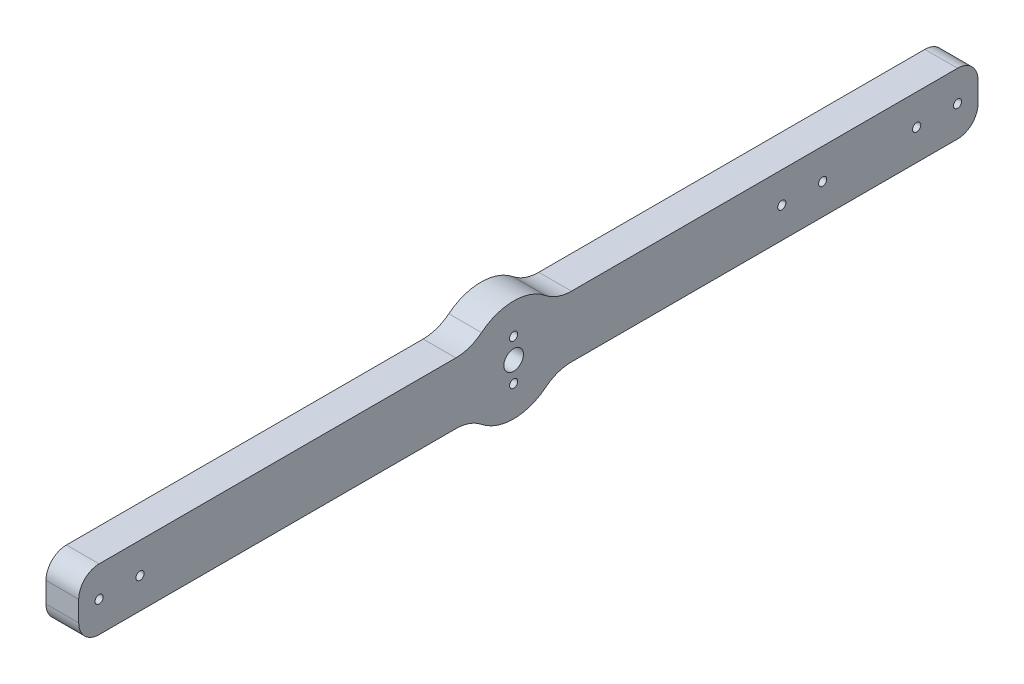
from build123d import *

# Parameters (mm, degrees)
SKETCH_1_W               = 120
SKETCH_1_H               = 15
EXTRUDE_1_DEPTH          = 8
FILLET_1_R               = 5
SKETCH_6_R               = 12.5
EXTRUDE_2_DEPTH          = 8
SKETCH_7_R               = 1
CUT_EXTRUDE_4_DEPTH      = 23
SKETCH_8_R               = 2.4
CUT_EXTRUDE_5_DEPTH      = 23
SKETCH_9_W               = 8
SKETCH_9_H               = 15
EXTRUDE_3_DEPTH          = 100
SKETCH_10_W              = 25
SKETCH_10_H              = 6
CUT_EXTRUDE_6_DEPTH      = 5
CUT_EXTRUDE_7_DEPTH      = 7
CUT_EXTRUDE_7_DEPTH_BACK = 15
SKETCH_4_R               = 1
FILLET_2_R               = 10
FILLET_4_R               = 5
CUT_EXTRUDE_8_REACH      = 123.918
SKETCH_12_R              = 1


with BuildPart() as part:
    # 草图1 → 凸台-拉伸1 (new body)
    with BuildSketch(Plane(origin=(0, 0, 0), x_dir=(0, 0, -1), z_dir=(1, 0, 0))):
        with Locations((60, 7.5)):
            Rectangle(SKETCH_1_W, SKETCH_1_H)
    extrude(amount=EXTRUDE_1_DEPTH)

    # 圆角1
    fillet_1_edges = [part.edges().sort_by_distance(p)[0] for p in [
        (4, 15, 0),
        (4, 15, -120),
        (4, 0, -120),
        (4, 0, 0),
    ]]
    fillet(fillet_1_edges, radius=FILLET_1_R)

    # 草图6 → 凸台-拉伸2 (add)
    with BuildSketch(Plane(origin=(8, 0, 0), x_dir=(0, 0, -1), z_dir=(1, 0, 0))):
        with Locations((6.4, 7.5)):
            Circle(SKETCH_6_R)
    extrude(amount=-EXTRUDE_2_DEPTH)

    # 草图7 → 切除-拉伸4 (cut)
    with BuildSketch(Plane.ZY):
        with Locations((-6.4, 12.5)):
            Circle(SKETCH_7_R)
        with Locations((-6.4, 2.5)):
            Circle(SKETCH_7_R)
    extrude(amount=-CUT_EXTRUDE_4_DEPTH, mode=Mode.SUBTRACT)

    # 草图8 → 切除-拉伸5 (cut)
    with BuildSketch(Plane.ZY):
        with Locations((-6.4, 7.5)):
            Circle(SKETCH_8_R)
    extrude(amount=-CUT_EXTRUDE_5_DEPTH, mode=Mode.SUBTRACT)

    # 草图9 → 凸台-拉伸3 (add)
    with BuildSketch(Plane.XY):
        with Locations((4, 7.5)):
            Rectangle(SKETCH_9_W, SKETCH_9_H)
    extrude(amount=EXTRUDE_3_DEPTH)

    # 草图10 → 切除-拉伸6 (cut)
    with BuildSketch(Plane.ZY):
        with Locations((16.022995474, 7.5)):
            Rectangle(SKETCH_10_W, SKETCH_10_H)
    extrude(amount=-CUT_EXTRUDE_6_DEPTH, mode=Mode.SUBTRACT)

    # 草图4 → 切除-拉伸7 (cut, two sides: drawn at the far end of the back side and taken through both)
    with BuildSketch(Plane.XY.offset(-CUT_EXTRUDE_7_DEPTH_BACK)):
        with Locations(Location((2.5, 7.5, 0), (0, 0, 180.000000002))):
            Circle(SKETCH_4_R)
    extrude(amount=CUT_EXTRUDE_7_DEPTH + CUT_EXTRUDE_7_DEPTH_BACK, mode=Mode.SUBTRACT)

    # 圆角2
    fillet_2_edges = [part.edges().sort_by_distance(p)[0] for p in [
        (4, 0, -16.4),
        (4, 15, -16.4),
        (4, 15, 3.6),
        (4, 0, 3.6),
    ]]
    fillet(fillet_2_edges, radius=FILLET_2_R)

    # 圆角4
    fillet_4_edges = [part.edges().sort_by_distance(p)[0] for p in [
        (4, 0, 100),
        (4, 15, 100),
    ]]
    fillet(fillet_4_edges, radius=FILLET_4_R)

    # 草图12 → 切除-拉伸8 (cut, up to next)
    with BuildSketch(Plane.ZY, mode=Mode.PRIVATE) as cut_extrude_8_sk1:
        with Locations((-115, 7.5)):
            Circle(SKETCH_12_R)
    cut_extrude_8_tool1 = extrude(cut_extrude_8_sk1.sketch, amount=-CUT_EXTRUDE_8_REACH, mode=Mode.PRIVATE) & part.part
    # 草图12 → 切除-拉伸8 (cut, up to next)
    with BuildSketch(Plane.ZY, mode=Mode.PRIVATE) as cut_extrude_8_sk2:
        with Locations((-105, 7.5)):
            Circle(SKETCH_12_R)
    cut_extrude_8_tool2 = extrude(cut_extrude_8_sk2.sketch, amount=-CUT_EXTRUDE_8_REACH, mode=Mode.PRIVATE) & part.part
    # 草图12 → 切除-拉伸8 (cut, up to next)
    with BuildSketch(Plane.ZY, mode=Mode.PRIVATE) as cut_extrude_8_sk3:
        with Locations((-82, 7.5)):
            Circle(SKETCH_12_R)
    cut_extrude_8_tool3 = extrude(cut_extrude_8_sk3.sketch, amount=-CUT_EXTRUDE_8_REACH, mode=Mode.PRIVATE) & part.part
    # 草图12 → 切除-拉伸8 (cut, up to next)
    with BuildSketch(Plane.ZY, mode=Mode.PRIVATE) as cut_extrude_8_sk4:
        with Locations((-72, 7.5)):
            Circle(SKETCH_12_R)
    cut_extrude_8_tool4 = extrude(cut_extrude_8_sk4.sketch, amount=-CUT_EXTRUDE_8_REACH, mode=Mode.PRIVATE) & part.part
    # 草图12 → 切除-拉伸8 (cut, up to next)
    with BuildSketch(Plane.ZY, mode=Mode.PRIVATE) as cut_extrude_8_sk5:
        with Locations((95, 7.5)):
            Circle(SKETCH_12_R)
    cut_extrude_8_tool5 = extrude(cut_extrude_8_sk5.sketch, amount=-CUT_EXTRUDE_8_REACH, mode=Mode.PRIVATE) & part.part
    # 草图12 → 切除-拉伸8 (cut, up to next)
    with BuildSketch(Plane.ZY, mode=Mode.PRIVATE) as cut_extrude_8_sk6:
        with Locations((85, 7.5)):
            Circle(SKETCH_12_R)
    cut_extrude_8_tool6 = extrude(cut_extrude_8_sk6.sketch, amount=-CUT_EXTRUDE_8_REACH, mode=Mode.PRIVATE) & part.part
    add(cut_extrude_8_tool1.solids().sort_by_distance((0, 7.5, -115))[0], mode=Mode.SUBTRACT)
    add(cut_extrude_8_tool2.solids().sort_by_distance((0, 7.5, -105))[0], mode=Mode.SUBTRACT)
    add(cut_extrude_8_tool3.solids().sort_by_distance((0, 7.5, -82))[0], mode=Mode.SUBTRACT)
    add(cut_extrude_8_tool4.solids().sort_by_distance((0, 7.5, -72))[0], mode=Mode.SUBTRACT)
    add(cut_extrude_8_tool5.solids().sort_by_distance((0, 7.5, 95))[0], mode=Mode.SUBTRACT)
    add(cut_extrude_8_tool6.solids().sort_by_distance((0, 7.5, 85))[0], mode=Mode.SUBTRACT)


solid = part.part
